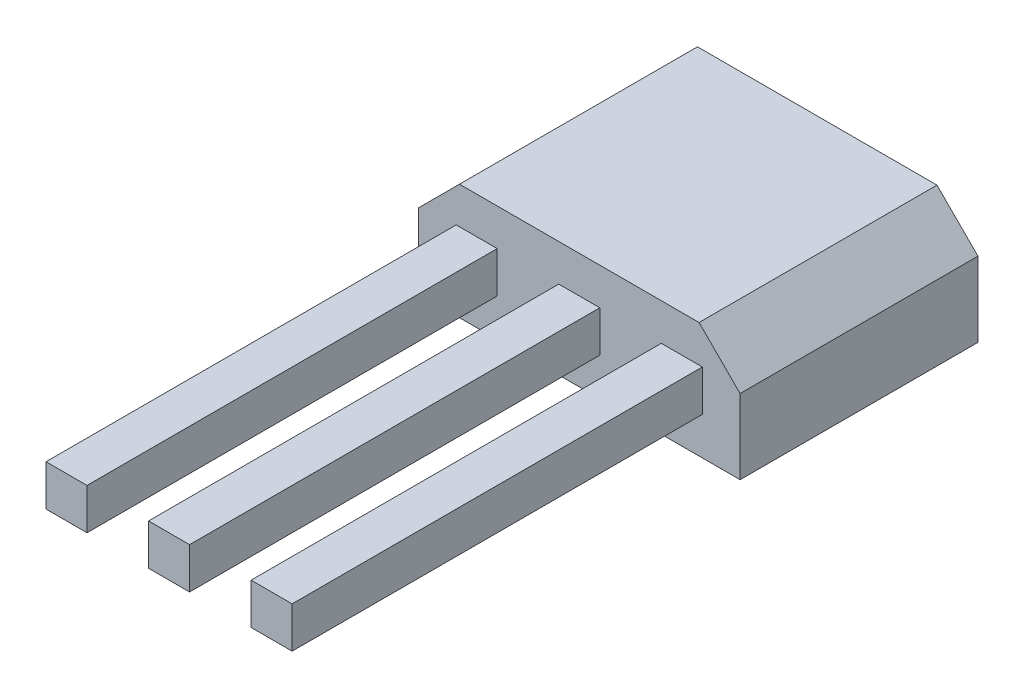
from build123d import *

# Parameters (mm, degrees)
SKETCH1_W           = 3.92
SKETCH1_H           = 2.9
BOSS_EXTRUDE1_DEPTH = 1.41
CHAMFER1_SIZE       = 0.5
SKETCH2_W           = 0.5
SKETCH2_H           = 0.5
BOSS_EXTRUDE2_DEPTH = 5


with BuildPart() as part:
    # Sketch1 → Boss-Extrude1 (new body)
    with BuildSketch(Plane(origin=(0, 0, 0), x_dir=(1, 0, 0), z_dir=(0, 1, 0))):
        with Locations((1.96, 1.45)):
            Rectangle(SKETCH1_W, SKETCH1_H)
    extrude(amount=BOSS_EXTRUDE1_DEPTH)

    # Chamfer1
    chamfer1_edges = [part.edges().sort_by_distance(p)[0] for p in [
        (3.92, 1.41, -1.45),
        (0, 1.41, -1.45),
    ]]
    chamfer(chamfer1_edges, length=CHAMFER1_SIZE)

    # Sketch2 → Boss-Extrude2 (add)
    with BuildSketch(Plane.XY):
        with Locations((0.71, 0.71)):
            Rectangle(SKETCH2_W, SKETCH2_H)
        with Locations((1.96, 0.71)):
            Rectangle(SKETCH2_W, SKETCH2_H)
        with Locations((3.21, 0.71)):
            Rectangle(SKETCH2_W, SKETCH2_H)
    extrude(amount=BOSS_EXTRUDE2_DEPTH)


solid = part.part
